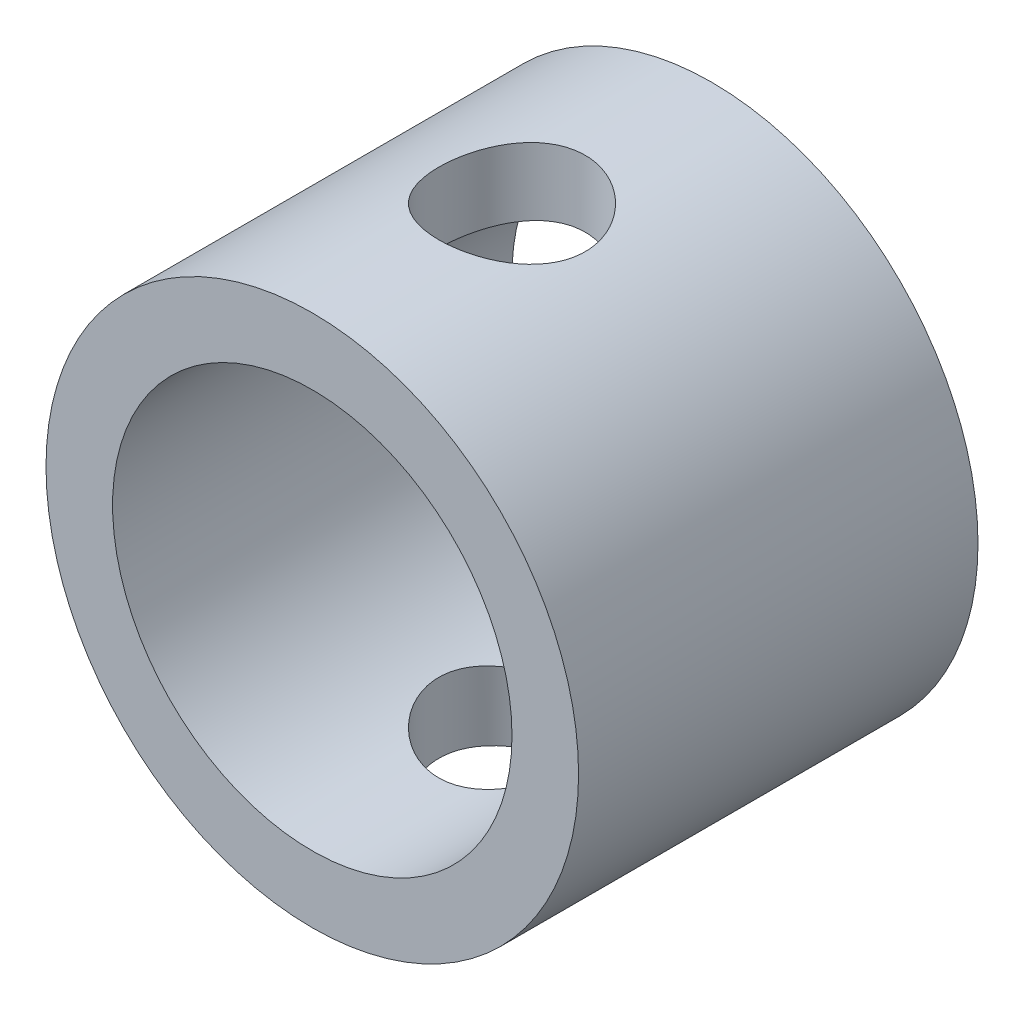
from build123d import *

# Parameters (mm, degrees)
IZIM1_R                     = 40
IZIM1_R_2                   = 30
Y_KSEKLIK_EKSTR_ZYON1_DEPTH = 60
IZIM2_R                     = 11
KES_EKSTR_ZYON1_DEPTH       = 80


with BuildPart() as part:
    # Çizim1 → Yükseklik-Ekstrüzyon1 (new body)
    with BuildSketch(Plane.XY):
        Circle(IZIM1_R)
        Circle(IZIM1_R_2, mode=Mode.SUBTRACT)
    extrude(amount=Y_KSEKLIK_EKSTR_ZYON1_DEPTH)

    # Çizim2 → Kes-Ekstrüzyon1 (cut, symmetric)
    with BuildSketch(Plane(origin=(0, 0, 0), x_dir=(1, 0, 0), z_dir=(0, 1, 0))):
        with Locations(Location((0, -30, 0), (0, 0, 270))):
            Circle(IZIM2_R)
    extrude(amount=KES_EKSTR_ZYON1_DEPTH, both=True, mode=Mode.SUBTRACT)


solid = part.part
